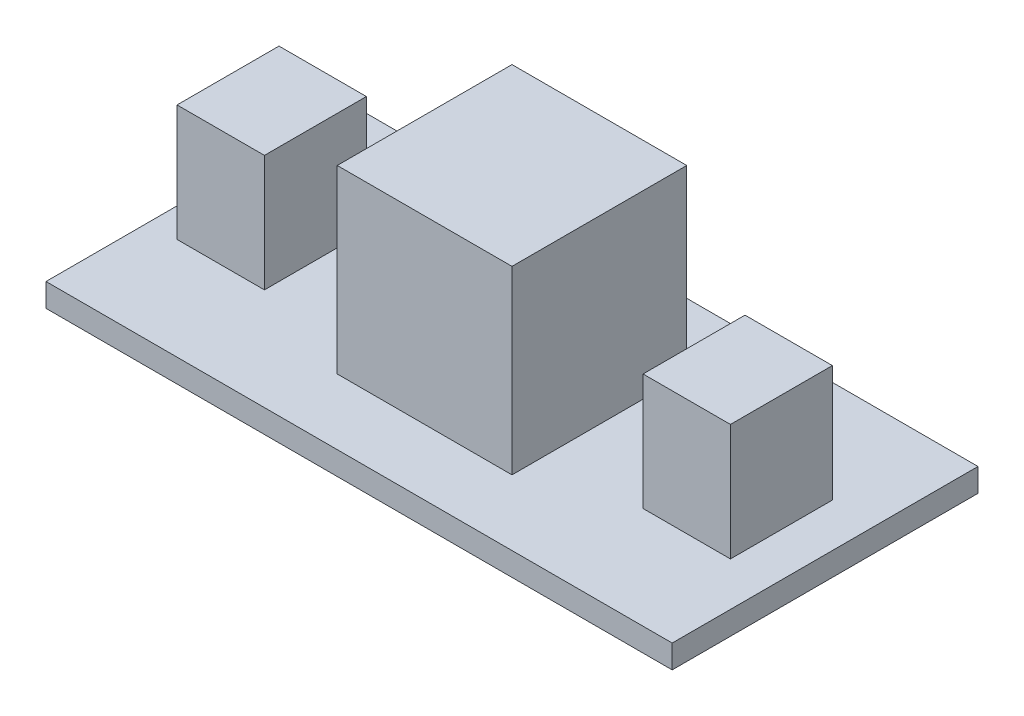
from build123d import *

# Parameters (mm, degrees)
SKETCH1_W        = 43
SKETCH1_H        = 21
BOARD_DEPTH      = 1.6
INDUCTOR_START   = 1.6
SKETCH2_W        = 12
SKETCH2_H        = 12
INDUCTOR_DEPTH   = 12.4
INPUT_CAP_START  = 1.6
SKETCH3_W        = 6
SKETCH3_H        = 7
INPUT_CAP_DEPTH  = 8
OUTPUT_CAP_START = 1.6
SKETCH4_W        = 6
SKETCH4_H        = 7
OUTPUT_CAP_DEPTH = 8


with BuildPart() as part:
    # Sketch1 → Board (new body)
    with BuildSketch(Plane(origin=(0, 0, 0), x_dir=(1, 0, 0), z_dir=(0, 1, 0))):
        Rectangle(SKETCH1_W, SKETCH1_H)
    extrude(amount=BOARD_DEPTH)

    # Sketch2 → Inductor (add)
    with BuildSketch(Plane(origin=(0, 0, 0), x_dir=(1, 0, 0), z_dir=(0, 1, 0)).offset(INDUCTOR_START)):
        Rectangle(SKETCH2_W, SKETCH2_H)
    extrude(amount=INDUCTOR_DEPTH)

    # Sketch3 → Input_Cap (add)
    with BuildSketch(Plane(origin=(0, 0, 0), x_dir=(1, 0, 0), z_dir=(0, 1, 0)).offset(INPUT_CAP_START)):
        with Locations((-16.5, 0)):
            Rectangle(SKETCH3_W, SKETCH3_H)
    extrude(amount=INPUT_CAP_DEPTH)

    # Sketch4 → Output_Cap (add)
    with BuildSketch(Plane(origin=(0, 0, 0), x_dir=(1, 0, 0), z_dir=(0, 1, 0)).offset(OUTPUT_CAP_START)):
        with Locations((15.5, 0)):
            Rectangle(SKETCH4_W, SKETCH4_H)
    extrude(amount=OUTPUT_CAP_DEPTH)


solid = part.part
